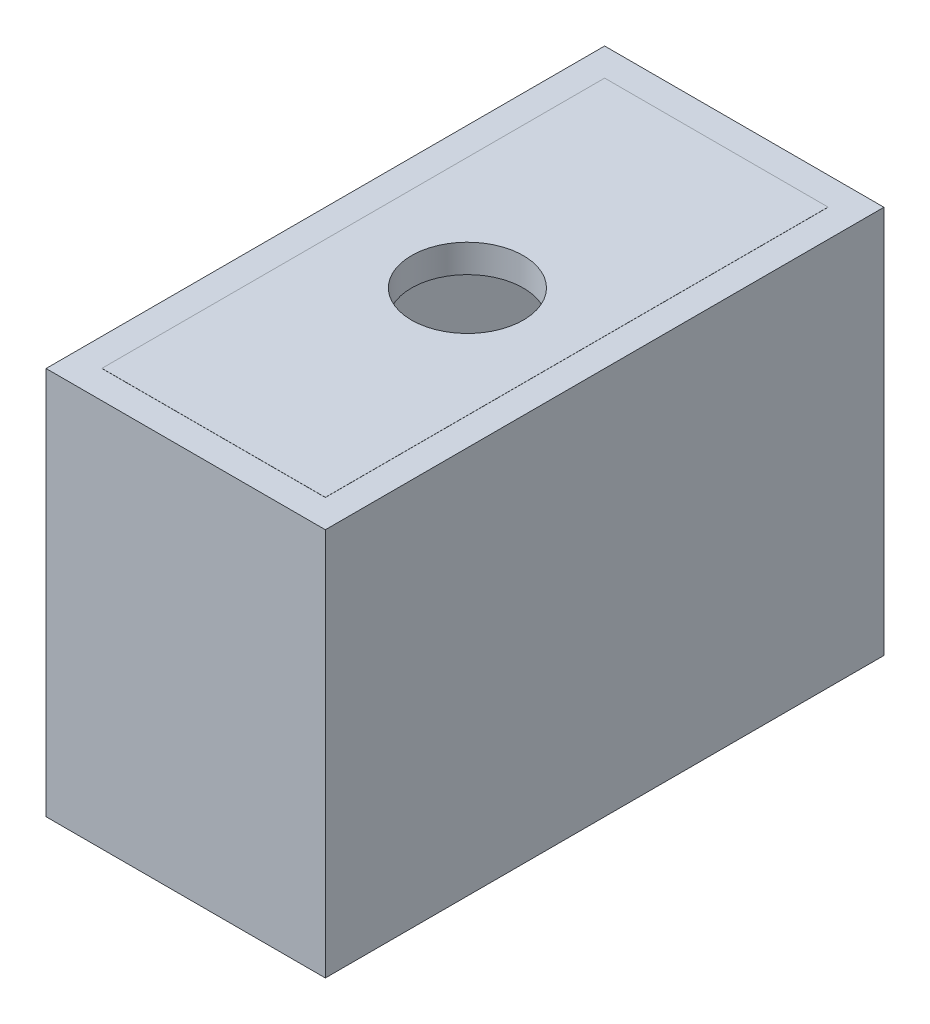
from build123d import *

# Parameters (mm, degrees)
SKETCH1_W                = 50.8
SKETCH1_H                = 101.6
SKETCH1_W_2              = 40.64
SKETCH1_H_2              = 91.44
BOSS_EXTRUDE1_DEPTH      = 70.61
BOSS_EXTRUDE2_DEPTH      = 0.0254
BOSS_EXTRUDE2_DEPTH_BACK = 5.08
SKETCH2_W                = 40.64
SKETCH2_H                = 91.44
SKETCH3_R                = 10.171709971
CUT_EXTRUDE1_DEPTH       = 106.159035776


with BuildPart() as part:
    # Sketch1 → Boss-Extrude1 (new body)
    with BuildSketch(Plane(origin=(0, 0, 0), x_dir=(1, 0, 0), z_dir=(0, 1, 0))):
        with Locations((-0.241139241, -22.763544304)):
            Rectangle(SKETCH1_W, SKETCH1_H)
        with Locations((-0.241139241, -22.763544304)):
            Rectangle(SKETCH1_W_2, SKETCH1_H_2, mode=Mode.SUBTRACT)
    extrude(amount=BOSS_EXTRUDE1_DEPTH)

    # Sketch2 → Boss-Extrude2 (add, two sides: drawn at the far end of the back side and taken through both)
    with BuildSketch(Plane(origin=(0, 70.61, 0), x_dir=(1, 0, 0), z_dir=(0, 1, 0)).offset(-BOSS_EXTRUDE2_DEPTH_BACK)):
        with Locations((-0.241139241, -22.763544304)):
            Rectangle(SKETCH2_W, SKETCH2_H)
    extrude(amount=BOSS_EXTRUDE2_DEPTH + BOSS_EXTRUDE2_DEPTH_BACK)

    # Sketch3 → Cut-Extrude1 (cut, through all)
    with BuildSketch(Plane(origin=(0, 70.6354, 0), x_dir=(1, 0, 0), z_dir=(0, 1, 0))):
        with Locations(Location((0, -22.565616606, 0), (0, 0, 270))):
            Circle(SKETCH3_R)
    extrude(amount=-CUT_EXTRUDE1_DEPTH, mode=Mode.SUBTRACT)


solid = part.part
